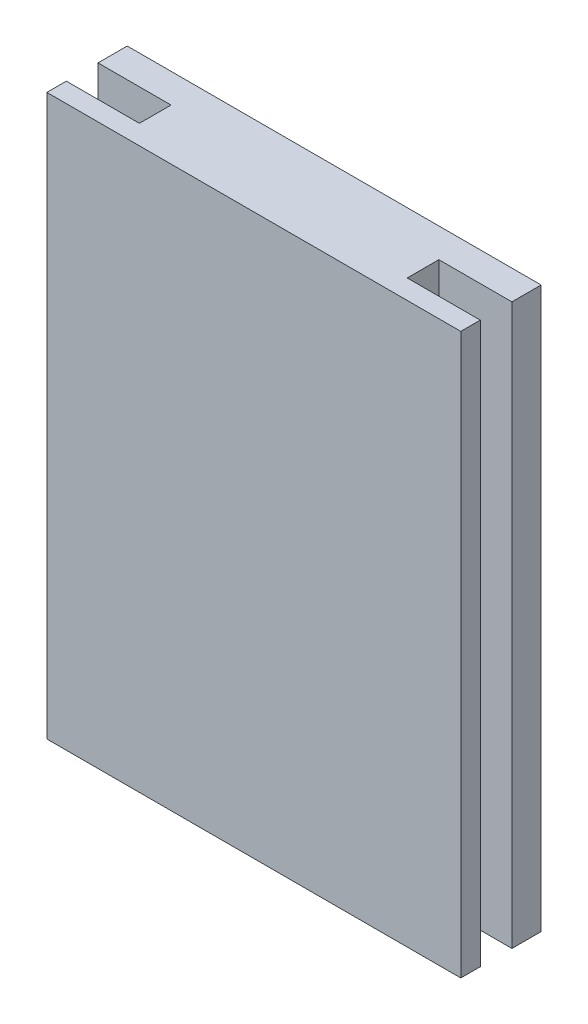
from build123d import *

# Parameters (mm, degrees)
SKETCH2_W               = 85
SKETCH2_H               = 115
BOSS_EXTRUDE1_DEPTH     = 15
SKETCH3_W               = 15
SKETCH3_H               = 4.5
CUT_EXTRUDE1_DEPTH      = 144.788038445
MIRROR2_COPY_1_SKETCH_W = 15
MIRROR2_COPY_1_SKETCH_H = 4.5
MIRROR2_COPY_1_DEPTH    = 144.788038445
SKETCH4_W               = 55
SKETCH4_H               = 115
BOSS_EXTRUDE2_DEPTH     = 2
SKETCH6_W               = 55
SKETCH6_H               = 115
CUT_EXTRUDE2_DEPTH      = 4.5
SKETCH5_W               = 85
SKETCH5_H               = 115
BOSS_EXTRUDE3_DEPTH     = 4


with BuildPart() as part:
    # Sketch2 → Boss-Extrude1 (new body)
    with BuildSketch(Plane.XY):
        with Locations((42.5, 57.5)):
            Rectangle(SKETCH2_W, SKETCH2_H)
    extrude(amount=BOSS_EXTRUDE1_DEPTH)

    # Sketch3 → Cut-Extrude1 (cut, through all)
    with BuildSketch(Plane(origin=(0, 115, 0), x_dir=(1, 0, 0), z_dir=(0, 1, 0))):
        with Locations((7.5, -12.75)):
            Rectangle(SKETCH3_W, SKETCH3_H)
    cut_extrude1 = extrude(amount=-CUT_EXTRUDE1_DEPTH, mode=Mode.SUBTRACT)

    # Mirror1: Cut-Extrude1 across plane
    add(cut_extrude1.mirror(Plane.XY.offset(7.5)), mode=Mode.SUBTRACT)

    # Mirror2: Cut-Extrude1 across plane
    add(cut_extrude1.mirror(Plane.ZY.offset(-42.5)), mode=Mode.SUBTRACT)

    # Mirror2 copy 1 sketch → Mirror2 copy 1 (cut, through all)
    with BuildSketch(Plane(origin=(85, 115, 15), x_dir=(-1, 0, 0), z_dir=(0, 1, 0))):
        with Locations((7.5, -12.75)):
            Rectangle(MIRROR2_COPY_1_SKETCH_W, MIRROR2_COPY_1_SKETCH_H)
    extrude(amount=-MIRROR2_COPY_1_DEPTH, mode=Mode.SUBTRACT)

    # Sketch4 → Boss-Extrude2 (add)
    with BuildSketch(Plane.XY.offset(15)):
        with Locations((42.5, 57.5)):
            Rectangle(SKETCH4_W, SKETCH4_H)
    extrude(amount=BOSS_EXTRUDE2_DEPTH)

    # Sketch6 → Cut-Extrude2 (cut)
    with BuildSketch(Plane(origin=(0, 0, 0), x_dir=(-1, 0, 0), z_dir=(0, 0, -1))):
        with Locations((-42.5, 57.5)):
            Rectangle(SKETCH6_W, SKETCH6_H)
    extrude(amount=-CUT_EXTRUDE2_DEPTH, mode=Mode.SUBTRACT)

    # Sketch5 → Boss-Extrude3 (add)
    with BuildSketch(Plane.XY.offset(17)):
        with Locations((42.5, 57.5)):
            Rectangle(SKETCH5_W, SKETCH5_H)
    extrude(amount=BOSS_EXTRUDE3_DEPTH)


solid = part.part
